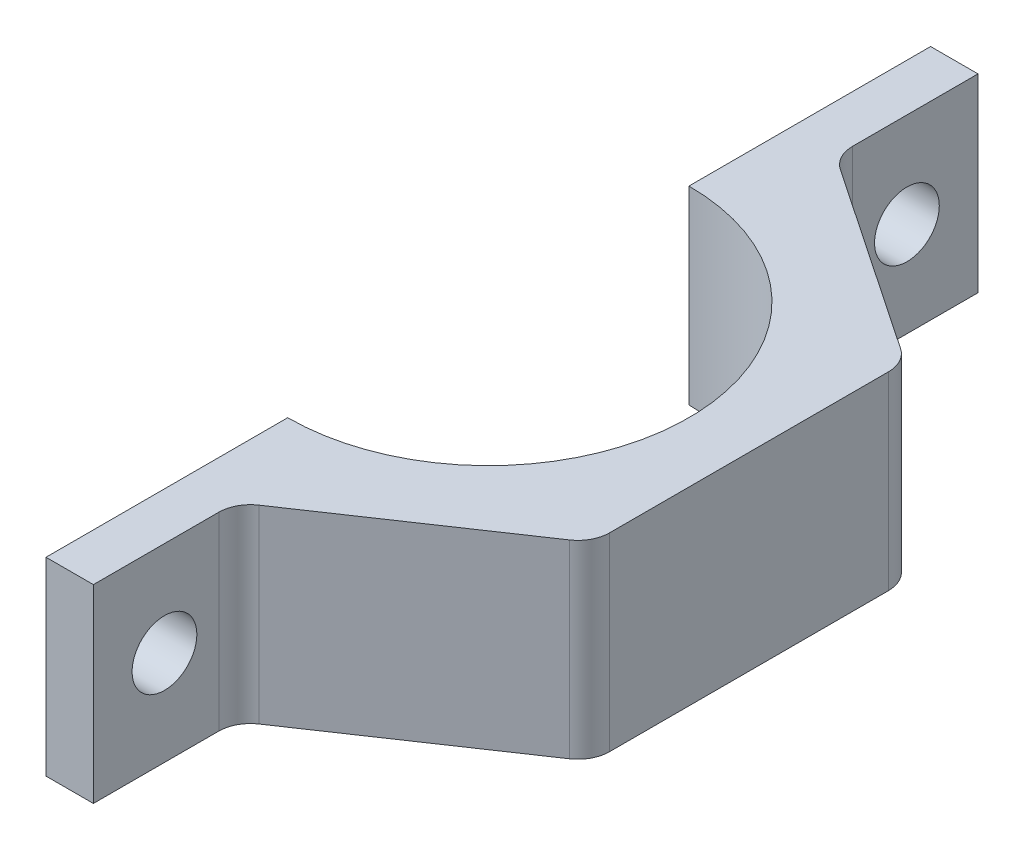
from build123d import *

# Parameters (mm, degrees)
BOSS_EXTRUDE1_DEPTH = 12
SKETCH2_R           = 2.05
CUT_EXTRUDE1_DEPTH  = 12


with BuildPart() as part:
    # Sketch1 → Boss-Extrude1 (new body)
    with BuildSketch(Plane(origin=(0, 0, 0), x_dir=(1, 0, 0), z_dir=(0, 1, 0))):
        with BuildLine():
            ThreePointArc((3.343223695, 18.942620076), (1.678008896, 19.162053286), (0, 19.235384062))
            Line((0, 19.235384062), (0, 12.7))
            ThreePointArc((0, 12.7), (8.980256121, 8.980256121), (12.7, 0))
            Line((12.7, 0), (16.500228948, 0))
            Line((16.500228948, 0), (16.500228948, 8.823548786))
            ThreePointArc((16.500228948, 8.823548786), (16.266303378, 9.762154724), (15.619247841, 10.481196733))
            Line((15.619247841, 10.481196733), (3.880981107, 18.405281137))
            ThreePointArc((3.880981107, 18.405281137), (3.586337017, 18.648165156), (3.343223695, 18.942620076))
        make_face()
        with BuildLine():
            Line((3, 28), (0, 28))
            Line((0, 28), (0, 19.235384062))
            ThreePointArc((0, 19.235384062), (1.678008896, 19.162053286), (3.343223695, 18.942620076))
            ThreePointArc((3.343223695, 18.942620076), (3.087730065, 19.477076121), (3, 20.062929084))
            Line((3, 20.062929084), (3, 28))
        make_face()
        with BuildLine():
            Line((16.500228948, 0), (12.7, 0))
            ThreePointArc((12.7, 0), (8.980256121, -8.980256121), (0, -12.7))
            Line((0, -12.7), (0, -19.235384062))
            ThreePointArc((0, -19.235384062), (1.678008896, -19.162053286), (3.343223695, -18.942620076))
            ThreePointArc((3.343223695, -18.942620076), (3.586337017, -18.648165156), (3.880981107, -18.405281137))
            Line((3.880981107, -18.405281137), (15.619247841, -10.481196733))
            ThreePointArc((15.619247841, -10.481196733), (16.266303378, -9.762154724), (16.500228948, -8.823548786))
            Line((16.500228948, -8.823548786), (16.500228948, 0))
        make_face()
        with BuildLine():
            ThreePointArc((3.343223695, -18.942620076), (1.678008896, -19.162053286), (0, -19.235384062))
            Line((0, -19.235384062), (0, -28))
            Line((0, -28), (3, -28))
            Line((3, -28), (3, -20.062929084))
            ThreePointArc((3, -20.062929084), (3.087730065, -19.477076121), (3.343223695, -18.942620076))
        make_face()
    extrude(amount=BOSS_EXTRUDE1_DEPTH)

    # Sketch2 → Cut-Extrude1 (cut)
    with BuildSketch(Plane(origin=(3, 0, 0), x_dir=(0, 0, -1), z_dir=(1, 0, 0))):
        with Locations((23.5, 6)):
            Circle(SKETCH2_R)
        with Locations((-23.5, 6)):
            Circle(SKETCH2_R)
    extrude(amount=-CUT_EXTRUDE1_DEPTH, mode=Mode.SUBTRACT)


solid = part.part
